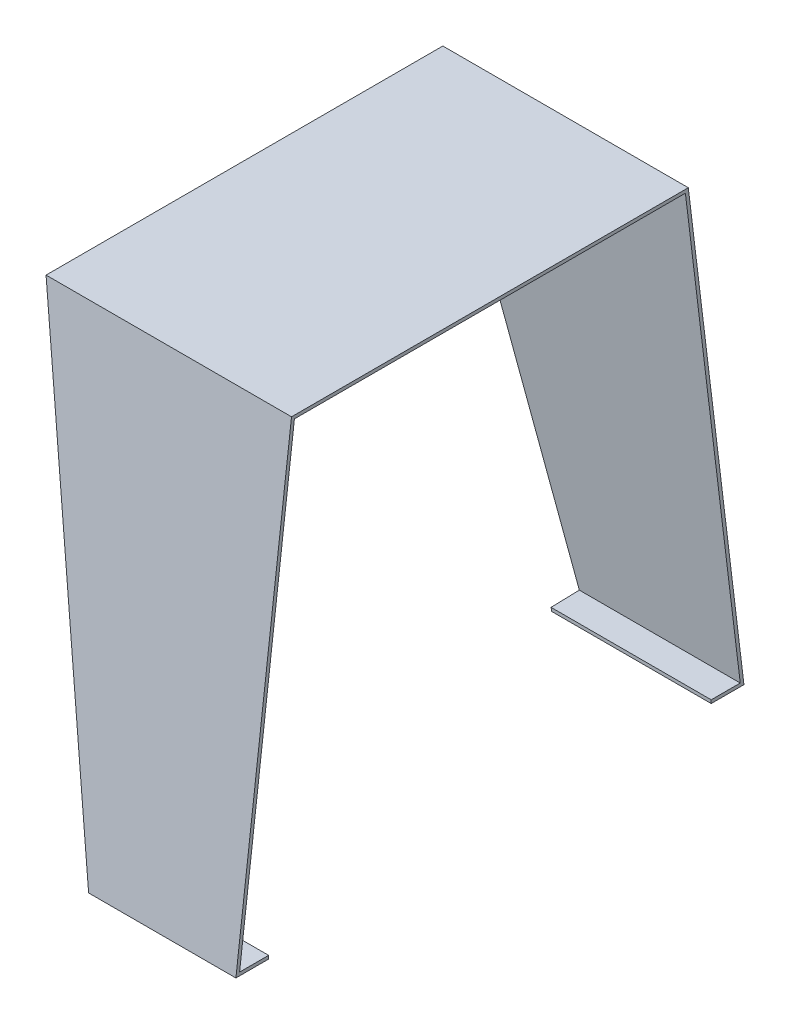
from build123d import *

# Parameters (mm, degrees)
EXTRUDE_1_DEPTH     = 150
CUT_EXTRUDE_1_DEPTH = 422.105843702
CUT_EXTRUDE_3_REACH = 421.779
SKETCH_3_W          = 150
SKETCH_3_H          = 270.46


with BuildPart() as part:
    # 草图1 → 凸台-拉伸1 (new body)
    with BuildSketch(Plane(origin=(0, 0, 0), x_dir=(0, 0, -1), z_dir=(1, 0, 0))):
        Polygon((0, 0), (-34, -280), (276.46, -280), (242.46, 0), align=None)
        Polygon((240.688166201, -2), (1.771833799, -2), (-31.742451915, -278), (274.202451915, -278), align=None, mode=Mode.SUBTRACT)
    extrude(amount=EXTRUDE_1_DEPTH)

    # 草图2 → 切除-拉伸1 (cut, through all)
    with BuildSketch(Plane(origin=(0, 0, 0), x_dir=(1, 0, 0), z_dir=(0, 0.1205431253958312, 0.9927080914950804))):
        Polygon((0, 0), (0, -282.056731882), (60, -282.056731882), align=None)
    extrude(amount=-CUT_EXTRUDE_1_DEPTH, mode=Mode.SUBTRACT)

    # 草图3 → 切除-拉伸3 (cut, up to next)
    with BuildSketch(Plane(origin=(0, -278, 0), x_dir=(1, 0, 0), z_dir=(0, 1, 0)), mode=Mode.PRIVATE) as cut_extrude_3_sk1:
        with Locations((75, 121.23)):
            Rectangle(SKETCH_3_W, SKETCH_3_H)
    cut_extrude_3_tool1 = extrude(cut_extrude_3_sk1.sketch, amount=-CUT_EXTRUDE_3_REACH, mode=Mode.PRIVATE) & part.part
    add(cut_extrude_3_tool1.solids().sort_by_distance((75, -278, -121.23))[0], mode=Mode.SUBTRACT)


solid = part.part
